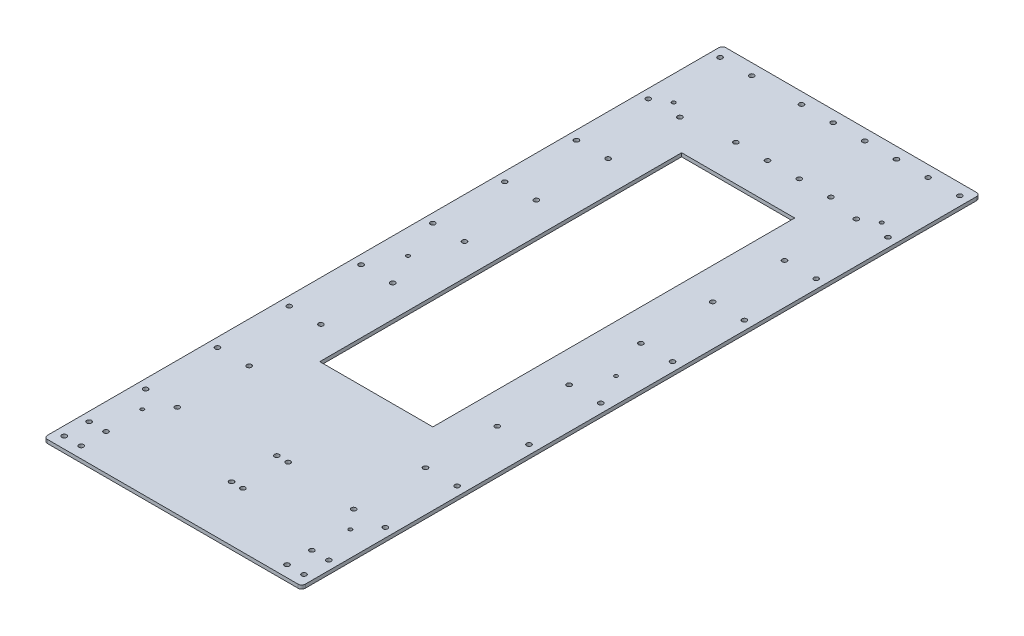
from build123d import *

# Parameters (mm, degrees)
SKETCH1_W           = 228
SKETCH1_H           = 600
SKETCH1_R           = 2.1
SKETCH1_R_2         = 1.6
SKETCH1_W_2         = 100
SKETCH1_H_2         = 320
BOSS_EXTRUDE1_DEPTH = 3.175
FILLET1_R           = 3.2


with BuildPart() as part:
    # Sketch1 → Boss-Extrude1 (new body)
    with BuildSketch(Plane(origin=(0, 0, 0), x_dir=(1, 0, 0), z_dir=(0, 1, 0))):
        Rectangle(SKETCH1_W, SKETCH1_H)
        with Locations(Location((106, 290, 0), (0, 0, 270))):
            Circle(SKETCH1_R, mode=Mode.SUBTRACT)
        with Locations(Location((106, -290, 0), (0, 0, 270))):
            Circle(SKETCH1_R, mode=Mode.SUBTRACT)
        with Locations(Location((78, 290, 0), (0, 0, 90))):
            Circle(SKETCH1_R, mode=Mode.SUBTRACT)
        with Locations(Location((92, 0, 0), (0, 0, 270))):
            Circle(SKETCH1_R_2, mode=Mode.SUBTRACT)
        with Locations(Location((92, 235, 0), (0, 0, 270))):
            Circle(SKETCH1_R_2, mode=Mode.SUBTRACT)
        with Locations(Location((92, -235, 0), (0, 0, 90))):
            Circle(SKETCH1_R_2, mode=Mode.SUBTRACT)
        with Locations(Location((-92, -235, 0), (0, 0, 270))):
            Circle(SKETCH1_R_2, mode=Mode.SUBTRACT)
        with Locations(Location((-106, -290, 0), (0, 0, 90))):
            Circle(SKETCH1_R, mode=Mode.SUBTRACT)
        with Locations(Location((50, 290, 0), (0, 0, 90))):
            Circle(SKETCH1_R, mode=Mode.SUBTRACT)
        with Locations(Location((22, 290, 0), (0, 0, 90))):
            Circle(SKETCH1_R, mode=Mode.SUBTRACT)
        with Locations(Location((-6, 290, 0), (0, 0, 90))):
            Circle(SKETCH1_R, mode=Mode.SUBTRACT)
        with Locations(Location((-34, 290, 0), (0, 0, 90))):
            Circle(SKETCH1_R, mode=Mode.SUBTRACT)
        with Locations(Location((50, 232, 0), (0, 0, 90))):
            Circle(SKETCH1_R, mode=Mode.SUBTRACT)
        with Locations(Location((22, 232, 0), (0, 0, 90))):
            Circle(SKETCH1_R, mode=Mode.SUBTRACT)
        with Locations(Location((-6, 232, 0), (0, 0, 90))):
            Circle(SKETCH1_R, mode=Mode.SUBTRACT)
        with Locations(Location((-34, 232, 0), (0, 0, 90))):
            Circle(SKETCH1_R, mode=Mode.SUBTRACT)
        with Locations(Location((91, -290, 0), (0, 0, 270))):
            Circle(SKETCH1_R, mode=Mode.SUBTRACT)
        with Locations(Location((91, -268, 0), (0, 0, 90))):
            Circle(SKETCH1_R, mode=Mode.SUBTRACT)
        with Locations(Location((106, -268, 0), (0, 0, 90))):
            Circle(SKETCH1_R, mode=Mode.SUBTRACT)
        with Locations(Location((-91, -290, 0), (0, 0, 90))):
            Circle(SKETCH1_R, mode=Mode.SUBTRACT)
        with Locations(Location((-106, -268, 0), (0, 0, 270))):
            Circle(SKETCH1_R, mode=Mode.SUBTRACT)
        with Locations(Location((-91, -268, 0), (0, 0, 270))):
            Circle(SKETCH1_R, mode=Mode.SUBTRACT)
        with Locations(Location((13, -251, 0), (0, 0, 270))):
            Circle(SKETCH1_R, mode=Mode.SUBTRACT)
        with Locations(Location((3, -251, 0), (0, 0, 270))):
            Circle(SKETCH1_R, mode=Mode.SUBTRACT)
        with Locations(Location((13, -211, 0), (0, 0, 90))):
            Circle(SKETCH1_R, mode=Mode.SUBTRACT)
        with Locations(Location((3, -211, 0), (0, 0, 90))):
            Circle(SKETCH1_R, mode=Mode.SUBTRACT)
        with Locations(Location((106, 226.5, 0), (0, 0, 270))):
            Circle(SKETCH1_R, mode=Mode.SUBTRACT)
        with Locations(Location((106, 163, 0), (0, 0, 270))):
            Circle(SKETCH1_R, mode=Mode.SUBTRACT)
        with Locations(Location((106, 99.5, 0), (0, 0, 270))):
            Circle(SKETCH1_R, mode=Mode.SUBTRACT)
        with Locations(Location((106, 36, 0), (0, 0, 270))):
            Circle(SKETCH1_R, mode=Mode.SUBTRACT)
        with Locations(Location((106, -27.5, 0), (0, 0, 270))):
            Circle(SKETCH1_R, mode=Mode.SUBTRACT)
        with Locations(Location((106, -91, 0), (0, 0, 270))):
            Circle(SKETCH1_R, mode=Mode.SUBTRACT)
        with Locations(Location((106, -154.5, 0), (0, 0, 270))):
            Circle(SKETCH1_R, mode=Mode.SUBTRACT)
        with Locations(Location((106, -218, 0), (0, 0, 270))):
            Circle(SKETCH1_R, mode=Mode.SUBTRACT)
        with Locations(Location((78, 226.5, 0), (0, 0, 90))):
            Circle(SKETCH1_R, mode=Mode.SUBTRACT)
        with Locations(Location((78, 163, 0), (0, 0, 90))):
            Circle(SKETCH1_R, mode=Mode.SUBTRACT)
        with Locations(Location((78, 99.5, 0), (0, 0, 90))):
            Circle(SKETCH1_R, mode=Mode.SUBTRACT)
        with Locations(Location((78, 36, 0), (0, 0, 90))):
            Circle(SKETCH1_R, mode=Mode.SUBTRACT)
        with Locations(Location((78, -27.5, 0), (0, 0, 90))):
            Circle(SKETCH1_R, mode=Mode.SUBTRACT)
        with Locations(Location((78, -91, 0), (0, 0, 90))):
            Circle(SKETCH1_R, mode=Mode.SUBTRACT)
        with Locations(Location((78, -154.5, 0), (0, 0, 90))):
            Circle(SKETCH1_R, mode=Mode.SUBTRACT)
        with Locations(Location((78, -218, 0), (0, 0, 90))):
            Circle(SKETCH1_R, mode=Mode.SUBTRACT)
        with Locations(Location((-78, -218, 0), (0, 0, 270))):
            Circle(SKETCH1_R, mode=Mode.SUBTRACT)
        with Locations(Location((-78, -154.5, 0), (0, 0, 270))):
            Circle(SKETCH1_R, mode=Mode.SUBTRACT)
        with Locations(Location((-106, -218, 0), (0, 0, 90))):
            Circle(SKETCH1_R, mode=Mode.SUBTRACT)
        with Locations(Location((-106, -154.5, 0), (0, 0, 90))):
            Circle(SKETCH1_R, mode=Mode.SUBTRACT)
        with Locations(Location((-78, -91, 0), (0, 0, 270))):
            Circle(SKETCH1_R, mode=Mode.SUBTRACT)
        with Locations(Location((-78, -27.5, 0), (0, 0, 270))):
            Circle(SKETCH1_R, mode=Mode.SUBTRACT)
        with Locations(Location((-106, -91, 0), (0, 0, 90))):
            Circle(SKETCH1_R, mode=Mode.SUBTRACT)
        with Locations(Location((-106, -27.5, 0), (0, 0, 90))):
            Circle(SKETCH1_R, mode=Mode.SUBTRACT)
        with Locations(Location((-78, 36, 0), (0, 0, 270))):
            Circle(SKETCH1_R, mode=Mode.SUBTRACT)
        with Locations(Location((-78, 99.5, 0), (0, 0, 270))):
            Circle(SKETCH1_R, mode=Mode.SUBTRACT)
        with Locations(Location((-106, 36, 0), (0, 0, 90))):
            Circle(SKETCH1_R, mode=Mode.SUBTRACT)
        with Locations(Location((-106, 99.5, 0), (0, 0, 90))):
            Circle(SKETCH1_R, mode=Mode.SUBTRACT)
        with Locations(Location((-78, 163, 0), (0, 0, 270))):
            Circle(SKETCH1_R, mode=Mode.SUBTRACT)
        with Locations(Location((-106, 163, 0), (0, 0, 90))):
            Circle(SKETCH1_R, mode=Mode.SUBTRACT)
        with Locations(Location((-78, 226.5, 0), (0, 0, 270))):
            Circle(SKETCH1_R, mode=Mode.SUBTRACT)
        with Locations(Location((-106, 226.5, 0), (0, 0, 90))):
            Circle(SKETCH1_R, mode=Mode.SUBTRACT)
        with Locations(Location((-92, 235, 0), (0, 0, 90))):
            Circle(SKETCH1_R_2, mode=Mode.SUBTRACT)
        with Locations(Location((-106, 290, 0), (0, 0, 90))):
            Circle(SKETCH1_R, mode=Mode.SUBTRACT)
        with Locations(Location((-78, 290, 0), (0, 0, 270))):
            Circle(SKETCH1_R, mode=Mode.SUBTRACT)
        with Locations(Location((-92, 0, 0), (0, 0, 90))):
            Circle(SKETCH1_R_2, mode=Mode.SUBTRACT)
        with Locations((0, 40)):
            Rectangle(SKETCH1_W_2, SKETCH1_H_2, mode=Mode.SUBTRACT)
    extrude(amount=BOSS_EXTRUDE1_DEPTH)

    # Fillet1
    fillet1_edges = [part.edges().sort_by_distance(p)[0] for p in [
        (114, 1.5875, 300),
        (-114, 1.5875, 300),
        (-114, 1.5875, -300),
        (114, 1.5875, -300),
    ]]
    fillet(fillet1_edges, radius=FILLET1_R)


solid = part.part
